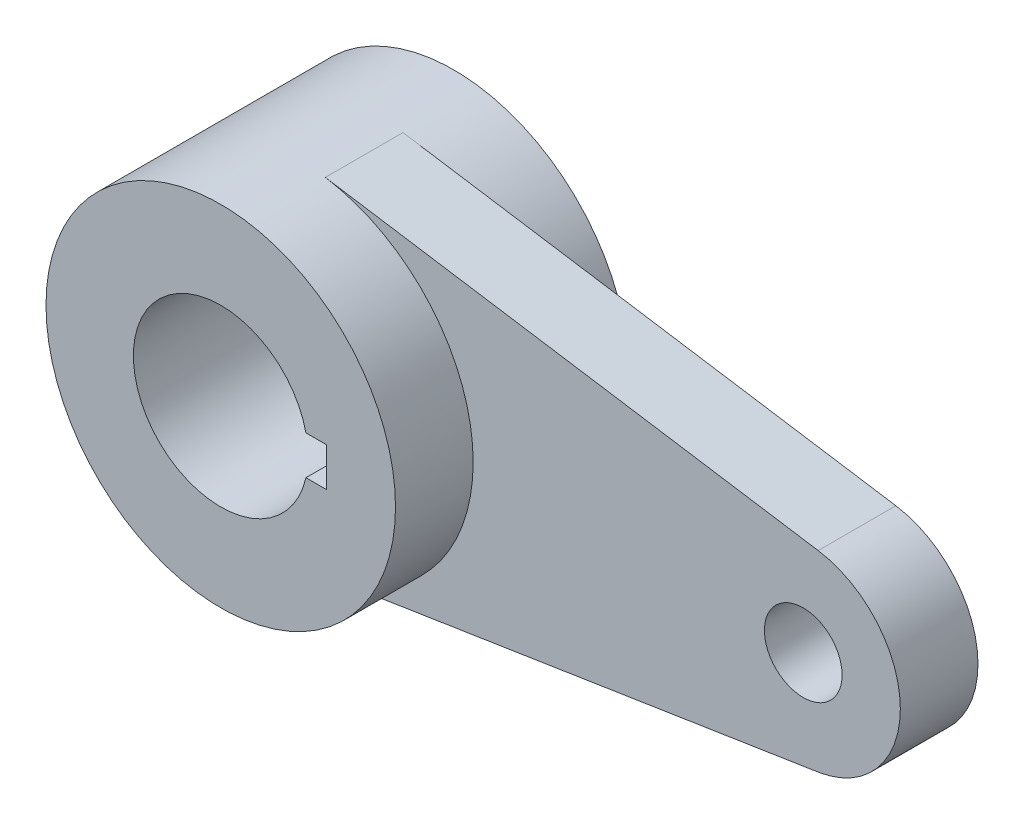
from build123d import *

# Parameters (mm, degrees)
SKETCH2_R               = 28.575
SKETCH2_R_2             = 14.2875
BOSS_EXTRUDE1_DEPTH     = 19.05
BOSS_EXTRUDE3_DEPTH     = 6.35
CUT_EXTRUDE3_DEPTH      = 105.251956428
CUT_EXTRUDE3_DEPTH_BACK = 105.251956428
SKETCH6_R               = 6.35
SKETCH6_W               = 3.341744035
SKETCH6_H               = 6.35


with BuildPart() as part:
    # Sketch2 → Boss-Extrude1 (new, symmetric)
    with BuildSketch(Plane.XY):
        with Locations(Location((-0.0317959, 0.136414209, 0), (0, 0, 180))):
            Circle(SKETCH2_R)
        with Locations(Location((-0.0317959, 0.136414209, 0), (0, 0, 180))):
            Circle(SKETCH2_R_2, mode=Mode.SUBTRACT)
    extrude(amount=BOSS_EXTRUDE1_DEPTH, both=True)

    # Sketch5 → Boss-Extrude3 (add, symmetric)
    with BuildSketch(Plane.XY):
        with BuildLine():
            Line((4.364357946, 28.371223512), (84.960511793, 15.822419377))
            ThreePointArc((84.960511793, 15.822419377), (98.3932041, 0.136414209), (84.960511793, -15.549590959))
            Line((84.960511793, -15.549590959), (4.364357946, -28.098395094))
            ThreePointArc((4.364357946, -28.098395094), (28.5432041, 0.136414209), (4.364357946, 28.371223512))
        make_face()
    extrude(amount=BOSS_EXTRUDE3_DEPTH, both=True)

    # Sketch6 → Cut-Extrude3 (cut, two sides: drawn at the far end of the back side and taken through both)
    with BuildSketch(Plane.XY.offset(-CUT_EXTRUDE3_DEPTH_BACK)):
        with Locations((82.5182041, 0.136414209)):
            Circle(SKETCH6_R)
        with Locations((15.569332083, 0.136414209)):
            Rectangle(SKETCH6_W, SKETCH6_H)
    extrude(amount=CUT_EXTRUDE3_DEPTH + CUT_EXTRUDE3_DEPTH_BACK, mode=Mode.SUBTRACT)


solid = part.part
